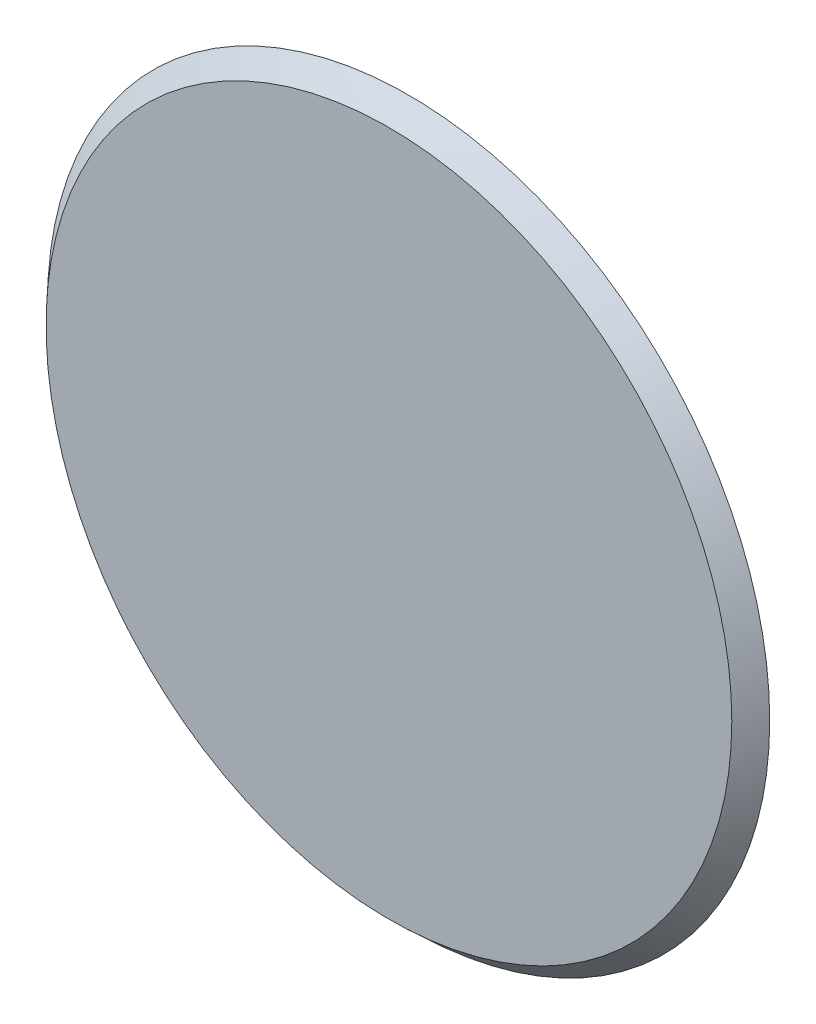
from build123d import *

# Parameters (mm, degrees)
SKETCH1_R           = 1000
BOSS_EXTRUDE2_DEPTH = 1
DOME1_FACE_RADIUS   = 1000
DOME1_HEIGHT        = 1000
CUT_EXTRUDE1_START  = -300
SKETCH2_R           = 1000
CUT_EXTRUDE1_DEPTH  = 300
SKETCH4_R           = 1000
CUT_EXTRUDE2_DEPTH  = 660


with BuildPart() as part:
    # Sketch1 → Boss-Extrude2 (new body)
    with BuildSketch(Plane.XY):
        Circle(SKETCH1_R)
    extrude(amount=BOSS_EXTRUDE2_DEPTH)

    # Dome1: a dome of height H over a round flat face of radius A is a cap of a sphere of radius (A * A + H * H) / (2 * H)
    dome1_r = (DOME1_FACE_RADIUS * DOME1_FACE_RADIUS + DOME1_HEIGHT * DOME1_HEIGHT) / (2 * DOME1_HEIGHT)
    dome1_base = Plane((0, 0, 1), z_dir=(0, 0, 1))
    with Locations(dome1_base.offset(DOME1_HEIGHT - dome1_r)):
        dome1_ball = Sphere(dome1_r, mode=Mode.PRIVATE)
    add(split(dome1_ball, bisect_by=dome1_base, keep=Keep.TOP, mode=Mode.PRIVATE))

    # Sketch2 → Cut-Extrude1 (cut)
    with BuildSketch(Plane.XY.offset(1001).offset(CUT_EXTRUDE1_START)):
        Circle(SKETCH2_R)
    extrude(amount=CUT_EXTRUDE1_DEPTH, mode=Mode.SUBTRACT)

    # Sketch4 → Cut-Extrude2 (cut)
    with BuildSketch(Plane(origin=(0, 0, 0), x_dir=(-1, 0, 0), z_dir=(0, 0, -1))):
        Circle(SKETCH4_R)
    extrude(amount=-CUT_EXTRUDE2_DEPTH, mode=Mode.SUBTRACT)


solid = part.part
